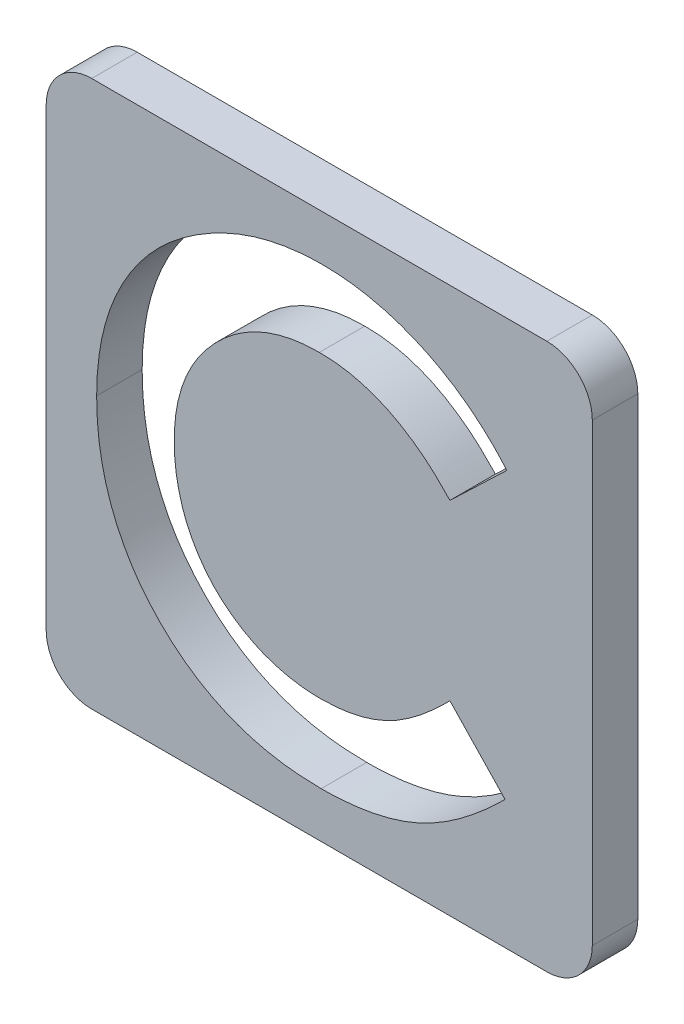
from build123d import *

# Parameters (mm, degrees)
BOSS_EXTRUDE1_DEPTH = 10
CUT_EXTRUDE16_DEPTH = 10


with BuildPart() as part:
    # Sketch1 → Boss-Extrude1 (new body)
    with BuildSketch(Plane.XY):
        with BuildLine():
            Line((-50, 60), (50, 60))
            ThreePointArc((50, 60), (57.071067812, 57.071067812), (60, 50))
            Line((60, 50), (60, -50))
            ThreePointArc((60, -50), (57.071067812, -57.071067812), (50, -60))
            Line((50, -60), (-50, -60))
            ThreePointArc((-50, -60), (-57.071067812, -57.071067812), (-60, -50))
            Line((-60, -50), (-60, 50))
            ThreePointArc((-60, 50), (-57.071067812, 57.071067812), (-50, 60))
        make_face()
    extrude(amount=BOSS_EXTRUDE1_DEPTH)

    # Sketch2 → Cut-Extrude16 (cut)
    with BuildSketch(Plane.XY.offset(10)):
        with BuildLine():
            Line((41.217948718, 31.01963141), (28.71494391, 19.068509615))
            add(Edge.make_bspline(
                [(28.71494391, 19.068509615), (27.654337183, 20.165178749), (25.582639967, 22.307317142), (22.244356118, 25.143319595), (18.772662463, 27.506743914), (15.235093873, 29.497204828), (11.568019744, 31.00313037), (7.813841439, 32.100523678), (3.948587424, 32.7695629), (1.332732176, 32.846112827), (0.017027244, 32.884615385)],
                knots=[0, 0, 0, 0, 1.115251505, 2.178435587, 3.19620269, 4.182487026, 5.141301733, 6.088180966, 7.038406374, 8, 8, 8, 8], degree=3))
            add(Edge.make_bspline(
                [(0.017027244, 32.884615385), (-1.081746264, 32.854197018), (-3.250054721, 32.794169724), (-6.433699741, 32.354110448), (-9.479020737, 31.605770498), (-12.396442325, 30.574419427), (-15.177379867, 29.239905879), (-17.827663943, 27.603262735), (-20.340760389, 25.679271209), (-22.683472657, 23.477886123), (-24.826503507, 21.072707488), (-26.720007718, 18.506387623), (-28.30612123, 15.784805822), (-29.60781879, 12.935524265), (-30.621790871, 9.945355068), (-31.345894329, 6.816311329), (-31.764696418, 3.544666601), (-31.827205437, 1.320626893), (-31.858974359, 0.190304487)],
                knots=[0, 0, 0, 0, 1.035432265, 2.043311493, 3.022114605, 3.98653278, 4.95457646, 5.923598177, 6.917315552, 7.932509744, 8.948865224, 9.949768934, 10.933144597, 11.912367597, 12.897413939, 13.903909035, 14.934704909, 16, 16, 16, 16], degree=3))
            add(Edge.make_bspline(
                [(-31.858974359, 0.190304487), (-31.849818918, -0.603034863), (-31.831773356, -2.166723023), (-31.634232763, -4.479851798), (-31.316145828, -6.72413356), (-30.855795226, -8.896168818), (-30.280122272, -10.997839879), (-29.604726818, -13.047277753), (-28.757453155, -15.016163821), (-27.816966606, -16.927365418), (-26.723191587, -18.728733016), (-25.543900342, -20.44648652), (-24.265151526, -22.072205676), (-22.878662607, -23.599244492), (-21.364920479, -25.003738772), (-19.763049776, -26.32792333), (-18.046029154, -27.538649342), (-16.249525485, -28.66630131), (-14.358019245, -29.645902168), (-12.422831386, -30.533231294), (-10.414620559, -31.25387447), (-8.357837936, -31.834778614), (-6.259833735, -32.328750831), (-4.100087524, -32.632904706), (-1.8973216, -32.863236875), (-0.408621569, -32.87745854), (0.340544872, -32.884615385)],
                knots=[0, 0, 0, 0, 1.103660481, 2.175337485, 3.227646561, 4.255952547, 5.262355991, 6.258840057, 7.255597736, 8.242457506, 9.22035537, 10.185017736, 11.140346927, 12.096287581, 13.051739095, 14.01125915, 14.986044842, 15.97314143, 16.960198552, 17.947847494, 18.933482797, 19.925264591, 20.920966487, 21.929612487, 22.958107872, 24, 24, 24, 24], degree=3))
            add(Edge.make_bspline(
                [(0.340544872, -32.884615385), (1.611259903, -32.847859563), (4.107884503, -32.77564393), (7.772040087, -32.210927911), (11.263615319, -31.282002017), (14.053367221, -30.184994512), (16.239064148, -29.101685359), (17.903002908, -28.09967774), (19.623645272, -26.978822204), (21.372412843, -25.696816449), (23.168975786, -24.269045058), (24.981620624, -22.664237173), (26.856751385, -20.935236817), (28.08513096, -19.701215296), (28.71494391, -19.068509615)],
                knots=[0, 0, 0, 0, 1.404581149, 2.759636711, 4.088442092, 5.392261763, 6.066678138, 6.783632037, 7.538459478, 8.336747902, 9.180226004, 10.074962426, 11.012997595, 12, 12, 12, 12], degree=3))
            Line((28.71494391, -19.068509615), (40.837339744, -31.799879808))
            add(Edge.make_bspline(
                [(40.837339744, -31.799879808), (39.985200566, -32.622593431), (38.322007128, -34.228354481), (35.813125998, -36.508385331), (33.307402394, -38.557246511), (30.865369379, -40.449302703), (28.447023904, -42.129433712), (26.052622431, -43.599317508), (23.709270632, -44.896129576), (21.368308056, -45.997999818), (19.015168024, -46.933602094), (16.594063463, -47.739094243), (14.097592829, -48.420511624), (11.510508817, -48.970325958), (8.856942171, -49.411202829), (6.112059034, -49.708792168), (3.293263318, -49.908851579), (1.381230514, -49.926828575), (0.416666667, -49.935897436)],
                knots=[0, 0, 0, 0, 1.244526981, 2.429050516, 3.560637417, 4.644440555, 5.67424972, 6.652764056, 7.595344123, 8.486817594, 9.369275933, 10.254498637, 11.166417451, 12.086725134, 13.032340136, 13.991389299, 14.986715468, 16, 16, 16, 16], degree=3))
            add(Edge.make_bspline(
                [(0.416666667, -49.935897436), (-1.35511764, -49.89073112), (-4.822007032, -49.802353196), (-9.902643041, -49.147532612), (-14.729110869, -48.049737439), (-19.313152407, -46.497152269), (-23.653310037, -44.513797477), (-27.748473415, -42.082297632), (-31.592042048, -39.209112847), (-35.152967466, -35.927919636), (-38.373993978, -32.304117189), (-41.221008401, -28.413147516), (-43.576058839, -24.235887927), (-45.531507964, -19.834049889), (-47.060643461, -15.187546107), (-48.136895621, -10.291350477), (-48.800612473, -5.150190581), (-48.87322404, -1.638659859), (-48.91025641, 0.15224359)],
                knots=[0, 0, 0, 0, 1.078019885, 2.10938526, 3.111377082, 4.085535484, 5.04941344, 6.010039228, 6.978205633, 7.964457913, 8.951525778, 9.924444315, 10.892603023, 11.863865945, 12.85144698, 13.863884204, 14.910567087, 16, 16, 16, 16], degree=3))
            add(Edge.make_bspline(
                [(-48.91025641, 0.15224359), (-48.894608325, 1.320255539), (-48.863597646, 3.634969751), (-48.537672531, 7.044731317), (-48.08331397, 10.368638931), (-47.362515429, 13.572179417), (-46.493663878, 16.698510375), (-45.41313282, 19.713652236), (-44.122648013, 22.626270824), (-42.663804821, 25.441242036), (-41.013430113, 28.140124795), (-39.169780387, 30.699731445), (-37.180318376, 33.139821677), (-34.99724055, 35.428023165), (-32.652269888, 37.584426764), (-30.134819118, 39.597346508), (-27.460029448, 41.495649937), (-24.620661217, 43.230384415), (-21.671875784, 44.799543954), (-18.650865094, 46.183609685), (-15.565051419, 47.340369909), (-12.42748186, 48.299859845), (-9.224900224, 49.016051238), (-5.980165725, 49.558185018), (-2.665669568, 49.861241267), (-0.440272542, 49.910853509), (0.683092949, 49.935897436)],
                knots=[0, 0, 0, 0, 1.071919942, 2.124283339, 3.142214191, 4.149696895, 5.136002878, 6.119640489, 7.086990633, 8.058538607, 9.028339693, 9.988281803, 10.952401235, 11.916291999, 12.888973767, 13.874849856, 14.873389453, 15.898127285, 16.927174885, 17.938320013, 18.946391617, 19.950418109, 20.947802303, 21.956882652, 22.968648068, 24, 24, 24, 24], degree=3))
            add(Edge.make_bspline(
                [(0.683092949, 49.935897436), (1.641438895, 49.921541632), (3.548166658, 49.892979285), (6.387604259, 49.654881043), (9.204333367, 49.280950163), (11.988269228, 48.716768097), (14.759325397, 48.047012689), (17.481087091, 47.170060366), (20.196491572, 46.192531741), (22.862951754, 45.024095868), (25.484189625, 43.74864257), (27.998798557, 42.301594484), (30.448998604, 40.772001333), (32.780494803, 39.069335094), (35.036961098, 37.255354635), (37.206598229, 35.321596721), (39.270366363, 33.235819929), (40.565472654, 31.7620955), (41.217948718, 31.01963141)],
                knots=[0, 0, 0, 0, 0.996412454, 1.982464992, 2.961075852, 3.949442424, 4.934965278, 5.923860011, 6.921385422, 7.934793307, 8.949617135, 9.951082467, 10.950285876, 11.951772932, 12.951063433, 13.960125323, 14.972308753, 16, 16, 16, 16], degree=3))
        make_face()
    extrude(amount=-CUT_EXTRUDE16_DEPTH, mode=Mode.SUBTRACT)


solid = part.part
